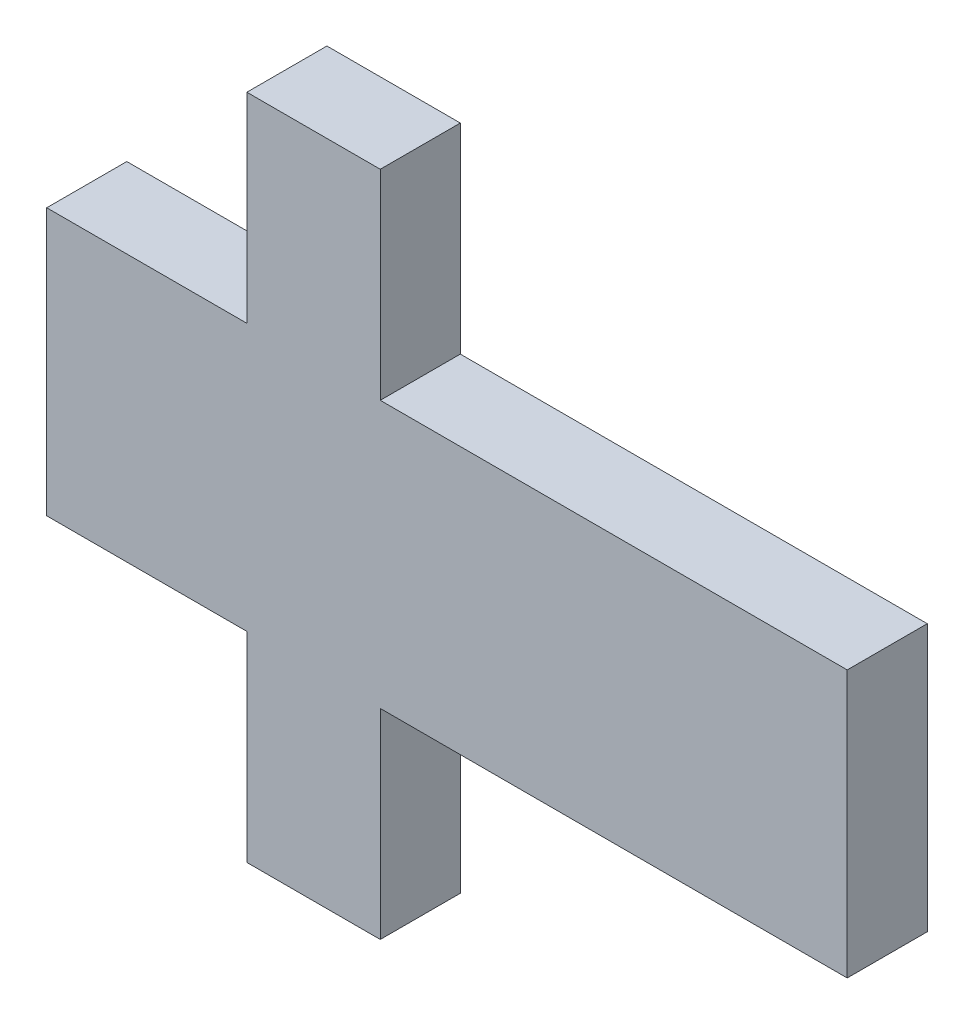
from build123d import *

# Parameters (mm, degrees)
SKETCH1_W           = 76.2
SKETCH1_H           = 25.4
BOSS_EXTRUDE1_DEPTH = 7.62
SKETCH2_R           = 0.863384433
CUT_EXTRUDE1_DEPTH  = 6.35
CHAMFER1_SIZE       = 0.508
SKETCH3_W           = 12.7
SKETCH3_H           = 19.05
BOSS_EXTRUDE2_DEPTH = 7.62


with BuildPart() as part:
    # Sketch1 → Boss-Extrude1 (new body)
    with BuildSketch(Plane.XY):
        with Locations((38.1, 12.7)):
            Rectangle(SKETCH1_W, SKETCH1_H)
    extrude(amount=BOSS_EXTRUDE1_DEPTH)

    # Sketch2 → Cut-Extrude1 (cut)
    with BuildSketch(Plane(origin=(0, 0, 0), x_dir=(-1, 0, 0), z_dir=(0, 0, -1))):
        with Locations((-25.4, 12.7)):
            Circle(SKETCH2_R)
        Polygon((-28.388596798, 21.04725), (-32.311403202, 21.04725), (-34.272806404, 17.65), (-32.311403202, 14.25275), (-28.388596798, 14.25275), (-26.427193596, 17.65), align=None)
        Polygon((-18.488596798, 21.04725), (-22.411403202, 21.04725), (-24.372806404, 17.65), (-22.411403202, 14.25275), (-18.488596798, 14.25275), (-16.527193596, 17.65), align=None)
        Polygon((-18.488596798, 11.14725), (-22.411403202, 11.14725), (-24.372806404, 7.75), (-22.411403202, 4.35275), (-18.488596798, 4.35275), (-16.527193596, 7.75), align=None)
        Polygon((-28.388596798, 11.14725), (-32.311403202, 11.14725), (-34.272806404, 7.75), (-32.311403202, 4.35275), (-28.388596798, 4.35275), (-26.427193596, 7.75), align=None)
    extrude(amount=-CUT_EXTRUDE1_DEPTH, mode=Mode.SUBTRACT)

    # Chamfer1
    chamfer1_edges = [part.edges().sort_by_distance(p)[0] for p in [
        (27.407895197, 9.448625, 0),
        (30.35, 11.14725, 0),
        (33.292104803, 9.448625, 0),
        (33.292104803, 6.051375, 0),
        (30.35, 4.35275, 0),
        (27.407895197, 6.051375, 0),
        (17.507895197, 9.448625, 0),
        (20.45, 11.14725, 0),
        (23.392104803, 9.448625, 0),
        (23.392104803, 6.051375, 0),
        (20.45, 4.35275, 0),
        (17.507895197, 6.051375, 0),
        (17.507895197, 19.348625, 0),
        (20.45, 21.04725, 0),
        (23.392104803, 19.348625, 0),
        (23.392104803, 15.951375, 0),
        (20.45, 14.25275, 0),
        (17.507895197, 15.951375, 0),
        (27.407895197, 19.348625, 0),
        (30.35, 21.04725, 0),
        (33.292104803, 19.348625, 0),
        (33.292104803, 15.951375, 0),
        (30.35, 14.25275, 0),
        (27.407895197, 15.951375, 0),
    ]]
    chamfer(chamfer1_edges, length=CHAMFER1_SIZE)

    # Sketch3 → Boss-Extrude2 (add)
    with BuildSketch(Plane(origin=(0, 0, 0), x_dir=(-1, 0, 0), z_dir=(0, 0, -1))):
        with Locations((-25.4, -9.525)):
            Rectangle(SKETCH3_W, SKETCH3_H)
        with Locations((-25.4, 34.925)):
            Rectangle(SKETCH3_W, SKETCH3_H)
    extrude(amount=-BOSS_EXTRUDE2_DEPTH)


solid = part.part
